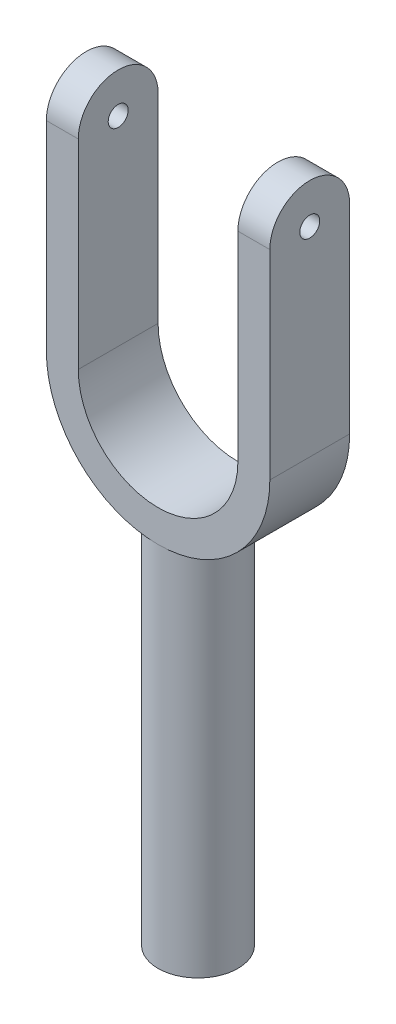
from build123d import *

# Parameters (mm, degrees)
BOSS_EXTRU_1_DEPTH      = 25
CONG_2_RADIUS           = 25
CONG_2_LENGTH           = 20
CONG_3_RADIUS           = 25
CONG_3_LENGTH           = 20
BOSS_EXTRU_3_REACH      = 458.098
BOSS_EXTRU_3_END_RADIUS = 70
ESQUISSE6_R             = 25
ESQUISSE7_R             = 6.25
ENL_V_MAT_EXTRU_1_DEPTH = 333.001506161


with BuildPart() as part:
    # Esquisse4 → Boss.-Extru.1 (new, symmetric)
    with BuildSketch(Plane.XY):
        with BuildLine():
            Line((-70, -2.817e-06), (-70, 149.999997183))
            Line((-70, 149.999997183), (-50, 149.999997183))
            Line((-50, 149.999997183), (-50, -2.817e-06))
            ThreePointArc((-50, -2.817e-06), (0, -50), (50, -2.817e-06))
            Line((50, -2.817e-06), (50, 149.999997183))
            Line((50, 149.999997183), (70, 149.999997183))
            Line((70, 149.999997183), (70, -2.817e-06))
            ThreePointArc((70, -2.817e-06), (0, -70), (-70, -2.817e-06))
        make_face()
    extrude(amount=BOSS_EXTRU_1_DEPTH, both=True)

    # Congé2: full round fillet: the end face becomes a half cylinder, R = half its width
    cong_2_face = Plane((-60, 149.999997183, 0), x_dir=(-1, 0, 0), z_dir=(0, 1, 0))  # on the end face: x along it, z out of the body
    cong_2_slab = cong_2_face.offset(-CONG_2_RADIUS / 2) * Box(CONG_2_LENGTH, 2 * CONG_2_RADIUS, CONG_2_RADIUS, mode=Mode.PRIVATE)  # the body's end, R deep
    cong_2_round = Plane((-60, 124.999997183, 0), x_dir=(0, 1, 0), z_dir=(-1, 0, 0)) * Cylinder(CONG_2_RADIUS, CONG_2_LENGTH, mode=Mode.PRIVATE)  # its axis R under the face
    add(cong_2_slab - cong_2_round, mode=Mode.SUBTRACT)

    # Congé3: full round fillet: the end face becomes a half cylinder, R = half its width
    cong_3_face = Plane((60, 149.999997183, 0), x_dir=(1, 0, 0), z_dir=(0, 1, 0))  # on the end face: x along it, z out of the body
    cong_3_slab = cong_3_face.offset(-CONG_3_RADIUS / 2) * Box(CONG_3_LENGTH, 2 * CONG_3_RADIUS, CONG_3_RADIUS, mode=Mode.PRIVATE)  # the body's end, R deep
    cong_3_round = Plane((60, 124.999997183, 0), x_dir=(0, 1, 0), z_dir=(1, 0, 0)) * Cylinder(CONG_3_RADIUS, CONG_3_LENGTH, mode=Mode.PRIVATE)  # its axis R under the face
    add(cong_3_slab - cong_3_round, mode=Mode.SUBTRACT)

    # Boss.-Extru.3: up to this cylinder (the profile starts outside it)
    boss_extru_3_end = Plane(origin=(0, 0, 0), z_dir=(0, 0, -1)) * Cylinder(BOSS_EXTRU_3_END_RADIUS, 1057.196, mode=Mode.PRIVATE)
    # Esquisse6 → Boss.-Extru.3 (add, up to the surface)
    with BuildSketch(Plane(origin=(0, -300, 0), x_dir=(1, 0, 0), z_dir=(0, 1, 0)), mode=Mode.PRIVATE) as boss_extru_3_sk1:
        with Locations(Location((0, 0, 0), (0, 0, 270))):
            Circle(ESQUISSE6_R)
    boss_extru_3_tool1 = extrude(boss_extru_3_sk1.sketch, amount=BOSS_EXTRU_3_REACH, mode=Mode.PRIVATE) - boss_extru_3_end
    add(boss_extru_3_tool1.solids().sort_by_distance((0, -300, 0))[0])

    # Esquisse7 → Enlèv. mat.-Extru.1 (cut, through all)
    with BuildSketch(Plane(origin=(70, 0, 0), x_dir=(0, 0, -1), z_dir=(1, 0, 0))):
        with Locations((0, 124.999997183)):
            Circle(ESQUISSE7_R)
    extrude(amount=-ENL_V_MAT_EXTRU_1_DEPTH, mode=Mode.SUBTRACT)


solid = part.part
